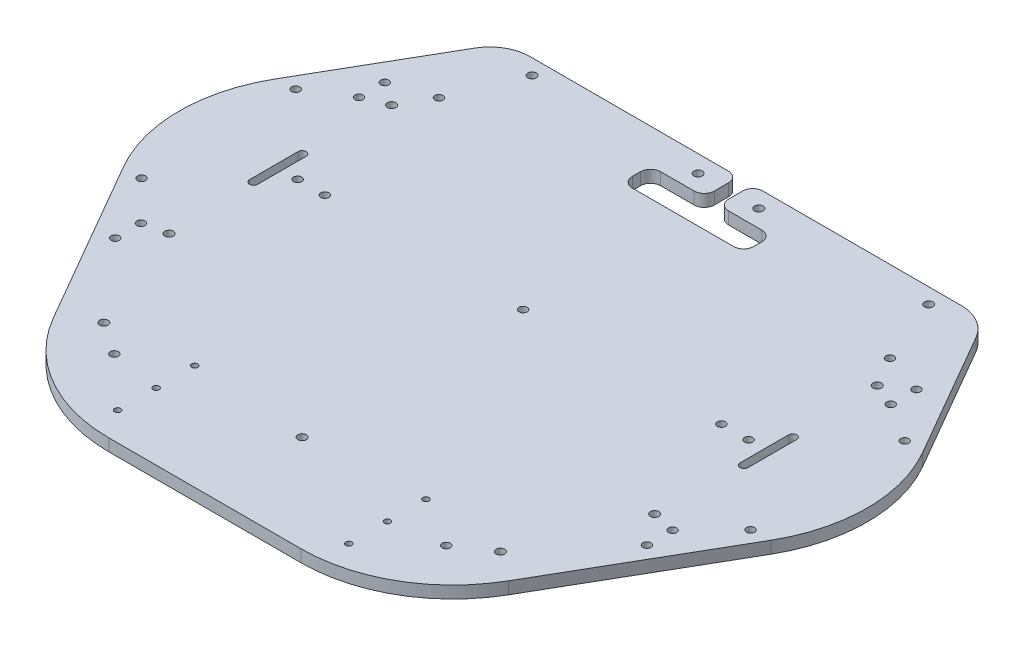
from build123d import *

# Parameters (mm, degrees)
ESBO_O1_R                = 2
ESBO_O1_R_2              = 2.1
RESSALTO_EXTRUS_O1_DEPTH = 6
ESBO_O3_R                = 1.5
CORTE_EXTRUS_O1_DEPTH    = 232.669186565


with BuildPart() as part:
    # Esboço1 → Ressalto-extrusão1 (new body)
    with BuildSketch(Plane(origin=(0, 6, 0), x_dir=(1, 0, 0), z_dir=(0, 1, 0))):
        with BuildLine():
            Line((-3.5, 98), (-3.5, 105))
            ThreePointArc((-3.5, 105), (-4.964466094, 108.535533906), (-8.5, 110))
            Line((-8.5, 110), (-106.547005384, 110))
            ThreePointArc((-106.547005384, 110), (-116.547005384, 107.320508076), (-123.867513459, 100))
            Line((-123.867513459, 100), (-159.951905284, 37.5))
            ThreePointArc((-159.951905284, 37.5), (-170, 0), (-159.951905284, -37.5))
            Line((-159.951905284, -37.5), (-112.451905284, -119.772413359))
            ThreePointArc((-112.451905284, -119.772413359), (-85, -147.224318643), (-47.5, -157.272413359))
            Line((-47.5, -157.272413359), (47.5, -157.272413359))
            ThreePointArc((47.5, -157.272413359), (85, -147.224318643), (112.451905284, -119.772413359))
            Line((112.451905284, -119.772413359), (159.951905284, -37.5))
            ThreePointArc((159.951905284, -37.5), (170, 0), (159.951905284, 37.5))
            Line((159.951905284, 37.5), (123.867513459, 100))
            ThreePointArc((123.867513459, 100), (116.547005384, 107.320508076), (106.547005384, 110))
            Line((106.547005384, 110), (8.5, 110))
            ThreePointArc((8.5, 110), (4.964466094, 108.535533906), (3.5, 105))
            Line((3.5, 105), (3.5, 98))
            ThreePointArc((3.5, 98), (4.964466094, 94.464466094), (8.5, 93))
            Line((8.5, 93), (25, 93))
            ThreePointArc((25, 93), (28.535533906, 91.535533906), (30, 88))
            Line((30, 88), (30, 84))
            ThreePointArc((30, 84), (28.535533906, 80.464466094), (25, 79))
            Line((25, 79), (-25, 79))
            ThreePointArc((-25, 79), (-28.535533906, 80.464466094), (-30, 84))
            Line((-30, 84), (-30, 88))
            ThreePointArc((-30, 88), (-28.535533906, 91.535533906), (-25, 93))
            Line((-25, 93), (-8.5, 93))
            ThreePointArc((-8.5, 93), (-4.964466094, 94.464466094), (-3.5, 98))
        make_face()
        with Locations(Location((-82, -120, 0), (0, 0, 90))):
            Circle(ESBO_O1_R, mode=Mode.SUBTRACT)
        with Locations(Location((82, -120, 0), (0, 0, 90))):
            Circle(ESBO_O1_R, mode=Mode.SUBTRACT)
        with Locations(Location((150.5, -38.1, 0), (0, 0, 90))):
            Circle(ESBO_O1_R, mode=Mode.SUBTRACT)
        with Locations(Location((150.5, 38.1, 0), (0, 0, 90))):
            Circle(ESBO_O1_R, mode=Mode.SUBTRACT)
        with Locations(Location((-150.5, -38.1, 0), (0, 0, 90))):
            Circle(ESBO_O1_R, mode=Mode.SUBTRACT)
        with Locations(Location((-150.5, 38.1, 0), (0, 0, 90))):
            Circle(ESBO_O1_R, mode=Mode.SUBTRACT)
        with Locations(Location((15, 101.5, 0), (0, 0, 90))):
            Circle(ESBO_O1_R_2, mode=Mode.SUBTRACT)
        with Locations(Location((98, 102.4382, 0), (0, 0, 90))):
            Circle(ESBO_O1_R_2, mode=Mode.SUBTRACT)
        with Locations(Location((-15, 101.5, 0), (0, 0, 90))):
            Circle(ESBO_O1_R_2, mode=Mode.SUBTRACT)
        with Locations(Location((131.4, -57.5, 0), (0, 0, 90))):
            Circle(ESBO_O1_R, mode=Mode.SUBTRACT)
        with Locations(Location((-131.4, -57.5, 0), (0, 0, 90))):
            Circle(ESBO_O1_R, mode=Mode.SUBTRACT)
        with Locations(Location((131.4, 63, 0), (0, 0, 90))):
            Circle(ESBO_O1_R, mode=Mode.SUBTRACT)
        with Locations(Location((-131.4, 63, 0), (0, 0, 90))):
            Circle(ESBO_O1_R, mode=Mode.SUBTRACT)
        with Locations(Location((131.4, -70.2, 0), (0, 0, 90))):
            Circle(ESBO_O1_R, mode=Mode.SUBTRACT)
        with Locations(Location((-131.4, -70.2, 0), (0, 0, 90))):
            Circle(ESBO_O1_R, mode=Mode.SUBTRACT)
        with Locations(Location((131.4, 50.3, 0), (0, 0, 90))):
            Circle(ESBO_O1_R, mode=Mode.SUBTRACT)
        with Locations(Location((-131.4, 50.3, 0), (0, 0, 90))):
            Circle(ESBO_O1_R, mode=Mode.SUBTRACT)
        with Locations(Location((120, 55, 0), (0, 0, 90))):
            Circle(ESBO_O1_R_2, mode=Mode.SUBTRACT)
        with Locations(Location((-120, 55, 0), (0, 0, 90))):
            Circle(ESBO_O1_R_2, mode=Mode.SUBTRACT)
        with Locations(Location((-120, -55, 0), (0, 0, 90))):
            Circle(ESBO_O1_R_2, mode=Mode.SUBTRACT)
        with Locations(Location((120, -55, 0), (0, 0, 90))):
            Circle(ESBO_O1_R_2, mode=Mode.SUBTRACT)
        with Locations(Location((111.4552, 0, 0), (0, 0, 90))):
            Circle(ESBO_O1_R, mode=Mode.SUBTRACT)
        with Locations(Location((111.4552, 69.85, 0), (0, 0, 90))):
            Circle(ESBO_O1_R, mode=Mode.SUBTRACT)
        with Locations(Location((-111.4552, 0, 0), (0, 0, 90))):
            Circle(ESBO_O1_R, mode=Mode.SUBTRACT)
        with Locations(Location((-111.4552, 69.85, 0), (0, 0, 90))):
            Circle(ESBO_O1_R, mode=Mode.SUBTRACT)
        with Locations(Location((-97.9932, 0, 0), (0, 0, 90))):
            Circle(ESBO_O1_R, mode=Mode.SUBTRACT)
        with Locations(Location((97.9932, 0, 0), (0, 0, 90))):
            Circle(ESBO_O1_R, mode=Mode.SUBTRACT)
        with Locations(Location((0, 0, 0), (0, 0, 90))):
            Circle(ESBO_O1_R, mode=Mode.SUBTRACT)
        with Locations(Location((98, -109.22, 0), (0, 0, 90))):
            Circle(ESBO_O1_R_2, mode=Mode.SUBTRACT)
        with Locations(Location((-98, -109.22, 0), (0, 0, 90))):
            Circle(ESBO_O1_R_2, mode=Mode.SUBTRACT)
        with Locations(Location((0, -109.22, 0), (0, 0, 90))):
            Circle(ESBO_O1_R_2, mode=Mode.SUBTRACT)
        with Locations(Location((-98, 102.4382, 0), (0, 0, 90))):
            Circle(ESBO_O1_R_2, mode=Mode.SUBTRACT)
        with BuildLine():
            Line((123.22, 12), (123.22, -12))
            ThreePointArc((123.22, -12), (121.22, -14), (119.22, -12))
            Line((119.22, -12), (119.22, 12))
            ThreePointArc((119.22, 12), (121.22, 14), (123.22, 12))
        make_face(mode=Mode.SUBTRACT)
        with BuildLine():
            Line((-123.22, -12), (-123.22, 12))
            ThreePointArc((-123.22, 12), (-121.22, 14), (-119.22, 12))
            Line((-119.22, 12), (-119.22, -12))
            ThreePointArc((-119.22, -12), (-121.22, -14), (-123.22, -12))
        make_face(mode=Mode.SUBTRACT)
    extrude(amount=-RESSALTO_EXTRUS_O1_DEPTH)

    # Esboço3 → Corte-extrusão1 (cut, through all)
    with BuildSketch(Plane(origin=(0, 6, 0), x_dir=(1, 0, 0), z_dir=(0, 1, 0))):
        with Locations(Location((-57.15, -143.272413359, 0), (0, 0, 270))):
            Circle(ESBO_O3_R)
        with Locations(Location((57.15, -143.272413359, 0), (0, 0, 270))):
            Circle(ESBO_O3_R)
        with Locations(Location((-57.15, -124.222413359, 0), (0, 0, 270))):
            Circle(ESBO_O3_R)
        with Locations(Location((57.15, -124.222413359, 0), (0, 0, 270))):
            Circle(ESBO_O3_R)
        with Locations(Location((-57.15, -105.172413359, 0), (0, 0, 270))):
            Circle(ESBO_O3_R)
        with Locations(Location((57.15, -105.172413359, 0), (0, 0, 270))):
            Circle(ESBO_O3_R)
    extrude(amount=-CORTE_EXTRUS_O1_DEPTH, mode=Mode.SUBTRACT)


solid = part.part
